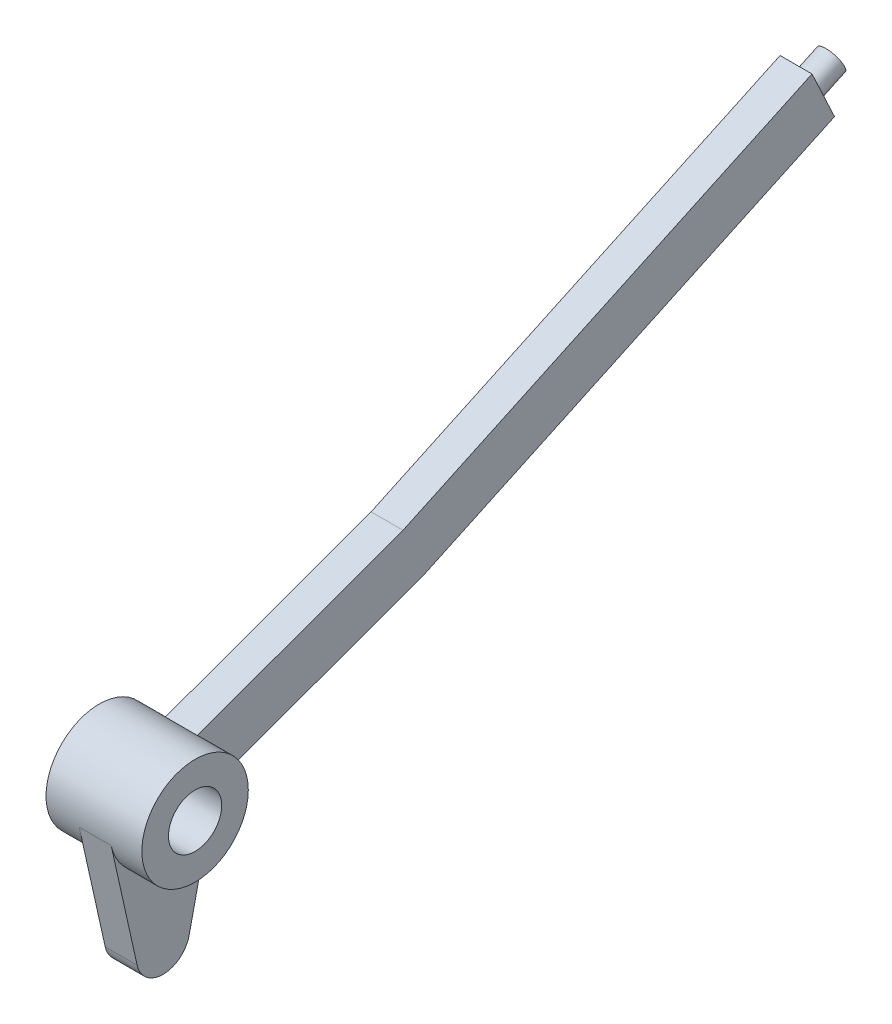
from build123d import *

# Parameters (mm, degrees)
SKETCH_1_R      = 10
SKETCH_1_R_2    = 5
EXTRUDE_1_DEPTH = 9
EXTRUDE_2_DEPTH = 3
EXTRUDE_3_DEPTH = 3
EXTRUDE_4_DEPTH = 3
SKETCH_5_R      = 2.5
EXTRUDE_5_DEPTH = 5


with BuildPart() as part:
    # 草图1 → 凸台-拉伸1 (new, symmetric)
    with BuildSketch(Plane(origin=(0, 0, 0), x_dir=(0, 0, -1), z_dir=(1, 0, 0))):
        Circle(SKETCH_1_R)
        Circle(SKETCH_1_R_2, mode=Mode.SUBTRACT)
    extrude(amount=EXTRUDE_1_DEPTH, both=True)

    # 草图2 → 凸台-拉伸2 (add, symmetric)
    with BuildSketch(Plane(origin=(0, 0, 0), x_dir=(0, 0, -1), z_dir=(1, 0, 0))):
        with BuildLine():
            Line((9.84807753, -1.736481777), (48.899871085, 12.477208672))
            Line((48.899871085, 12.477208672), (126.133884246, 48.492020479))
            Line((126.133884246, 48.492020479), (121.907701629, 57.555098349))
            Line((121.907701629, 57.555098349), (45.069390993, 21.72480566))
            Line((45.069390993, 21.72480566), (6.427876097, 7.660444431))
            ThreePointArc((6.427876097, 7.660444431), (9.396926208, 3.420201433), (9.84807753, -1.736481777))
        make_face()
    extrude(amount=EXTRUDE_2_DEPTH, both=True)

    # 草图3 → 凸台-拉伸3 (add, symmetric)
    with BuildSketch(Plane(origin=(0, 0, 0), x_dir=(0, 0, -1), z_dir=(1, 0, 0))):
        with BuildLine():
            Line((-9.760845357, -2.173913043), (-4.880422678, -24.086956522))
            ThreePointArc((-4.880422678, -24.086956522), (0, -28), (4.880422678, -24.086956522))
            Line((4.880422678, -24.086956522), (9.760845357, -2.173913043))
            ThreePointArc((9.760845357, -2.173913043), (0, -10), (-9.760845357, -2.173913043))
        make_face()
    extrude(amount=EXTRUDE_3_DEPTH, both=True)

    # 草图4 → 凸台-拉伸4 (add, symmetric)
    with BuildSketch(Plane(origin=(0, 0, 0), x_dir=(0, 0, -1), z_dir=(1, 0, 0))):
        with BuildLine():
            Line((9.760845357, -2.173913043), (9.26353243, -4.406842549))
            ThreePointArc((9.26353243, -4.406842549), (10.386363512, -2.195237961), (12.433854391, -0.795335967))
            Line((12.433854391, -0.795335967), (9.84807753, -1.736481777))
            ThreePointArc((9.84807753, -1.736481777), (9.806900669, -1.955683838), (9.760845357, -2.173913043))
        make_face()
    extrude(amount=EXTRUDE_4_DEPTH, both=True)

    # 草图5 → 凸台-拉伸5 (add)
    with BuildSketch(Plane(origin=(0, 56.973055831, -122.179112512), x_dir=(-1, 0, 0), z_dir=(0, 0.422618261740695, -0.9063077870366522))):
        with Locations(Location((0, -4.357787137, 0), (0, 0, 90))):
            Circle(SKETCH_5_R)
    extrude(amount=EXTRUDE_5_DEPTH)


solid = part.part
